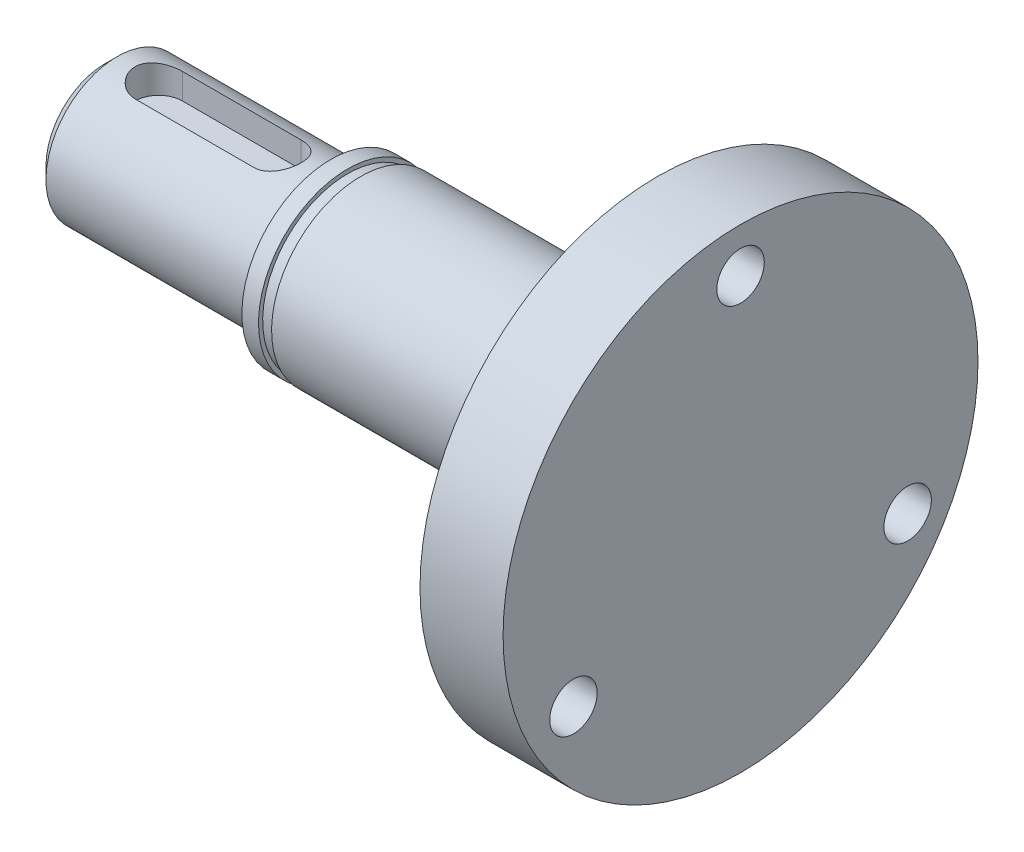
from build123d import *

# Parameters (mm, degrees)
CIRPATTERN1_COUNT  = 3
CUT_EXTRUDE1_START = 6
CUT_EXTRUDE1_DEPTH = 2.5
ECHELLE1_SCALE     = 2
ECHELLE2_SCALE     = 0.25


with BuildPart() as part:
    # Sketch1 → Revolve3 (revolve)
    with BuildSketch(Plane.XY):
        Polygon((0, 0), (0, 5), (1, 6), (19, 6), (19, 7.5), (20.4, 7.5), (20.4, 7.15), (21.5, 7.15), (21.5, 7.5), (46, 7.5), (46, 10), (46.5, 10), (46.5, 20), (53.5, 20), (53.5, 0), align=None)
    revolve(axis=Axis((0, 0, 0), (1, 0, 0)))

    # Sketch3 → Ø4.0 (4) Diameter Hole1 (revolve, cut)
    with BuildSketch(Plane(origin=(53.5, 16.25, 0), x_dir=(0, 0, -1), z_dir=(0, 1, 0))):
        Polygon((0, 0), (0, 13.201721238), (2, 12), (2, 0), align=None)
    f_4_0_4_diameter_hole1 = revolve(axis=Axis((59.85, 16.25, 0), (-1, 0, 0)), mode=Mode.SUBTRACT)

    # CirPattern1: Ø4.0 (4) Diameter Hole1 ×3 about axis
    cirpattern1_axis = Axis((53.5, 0, 0), (-1, 0, 0))
    for i in range(1, CIRPATTERN1_COUNT):
        add(f_4_0_4_diameter_hole1.rotate(cirpattern1_axis, i * 360 / CIRPATTERN1_COUNT), mode=Mode.SUBTRACT)

    # Sketch6 → Cut-Extrude1 (cut)
    with BuildSketch(Plane(origin=(0, 0, 0), x_dir=(1, 0, 0), z_dir=(0, 1, 0)).offset(CUT_EXTRUDE1_START)):
        with BuildLine():
            Line((4.5, -2), (14.5, -2))
            ThreePointArc((14.5, -2), (16.5, 0), (14.5, 2))
            Line((14.5, 2), (4.5, 2))
            ThreePointArc((4.5, 2), (2.5, 0), (4.5, -2))
        make_face()
    extrude(amount=-CUT_EXTRUDE1_DEPTH, mode=Mode.SUBTRACT)


with BuildPart() as part_1:
    # Echelle1: scaled about (39.34389117, -0.038274574, 5e-09)
    add(part.part.scale(ECHELLE1_SCALE).moved(Location((-39.34389117, 0.038274574, -5e-09))))


with BuildPart() as part_2:
    # Echelle2: scaled about (39.343891171, -0.038274573, 4e-09)
    add(part_1.part.scale(ECHELLE2_SCALE).moved(Location((29.507918378, -0.02870593, 3e-09))))


solid = part_2.part
